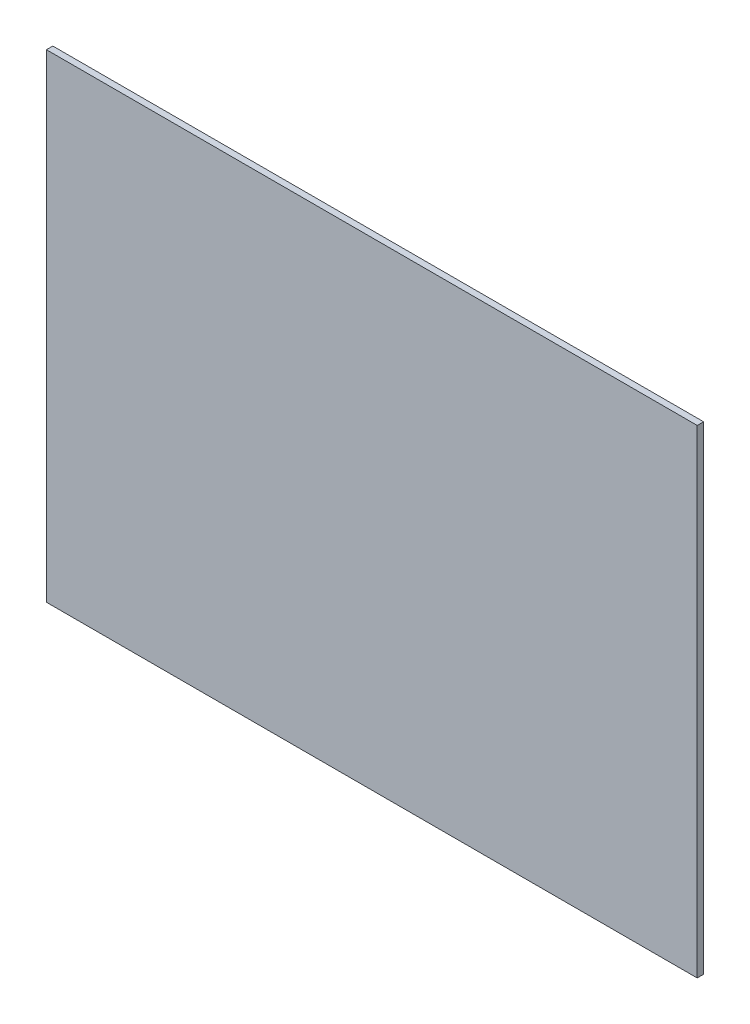
from build123d import *

# Parameters (mm, degrees)
SKETCH1_W           = 204
SKETCH1_H           = 150
BOSS_EXTRUDE1_DEPTH = 2


with BuildPart() as part:
    # Sketch1 → Boss-Extrude1 (new body)
    with BuildSketch(Plane.XY):
        with Locations((3.767045455, -38.198863636)):
            Rectangle(SKETCH1_W, SKETCH1_H)
    extrude(amount=BOSS_EXTRUDE1_DEPTH)


solid = part.part
